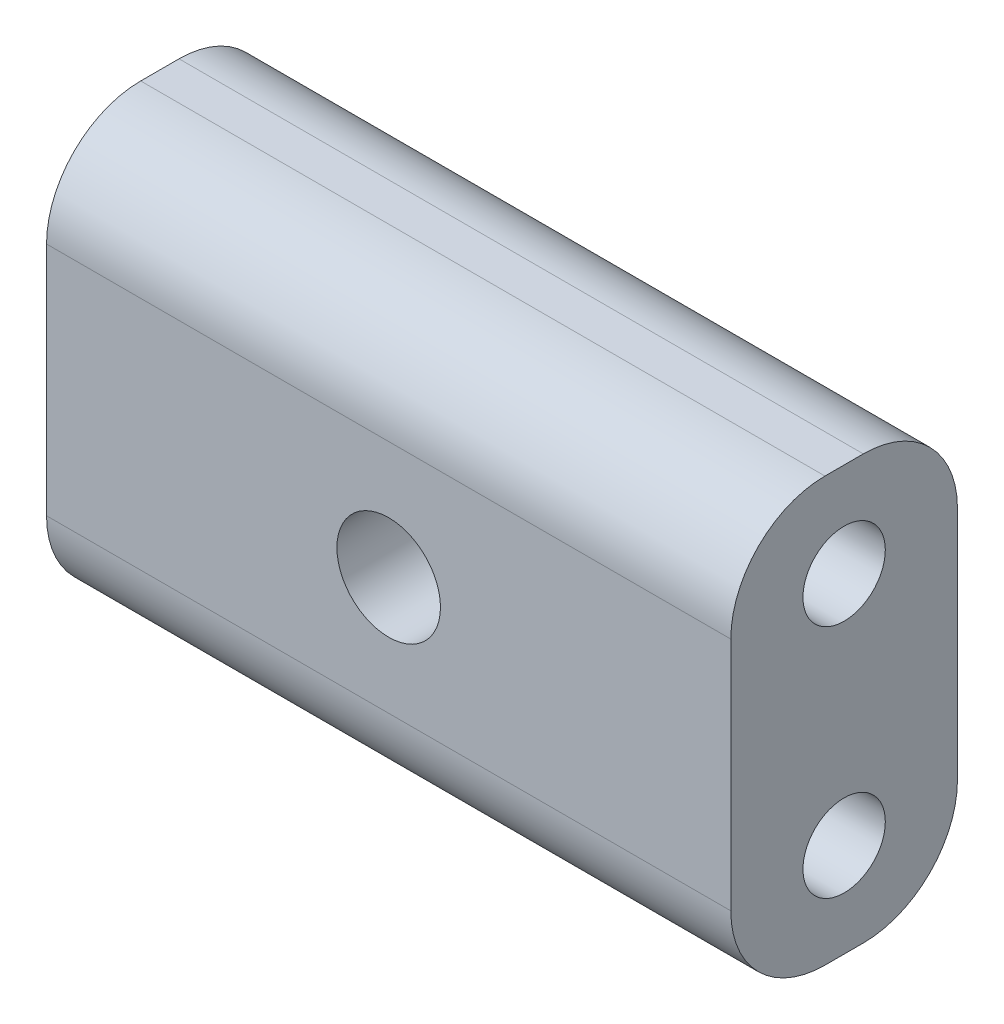
from build123d import *

# Parameters (mm, degrees)
SKETCH1_W         = 29.075
SKETCH1_H         = 18
EXTRUDE_3_8_DEPTH = 9.63
SKETCH2_R         = 1.75
M4_DRILL_DEPTH    = 8
M4_DRILL2_START   = -8
SKETCH3_R         = 1.75
M4_DRILL2_DEPTH   = 8
SKETCH5_R         = 2.2
M5_DRILL_DEPTH    = 9.63
FILLET1_R         = 4


with BuildPart() as part:
    # Sketch1 → 3/8 (new body)
    with BuildSketch(Plane.XY):
        Rectangle(SKETCH1_W, SKETCH1_H)
    extrude(amount=EXTRUDE_3_8_DEPTH)

    # Sketch2 → M4_DRILL (cut)
    with BuildSketch(Plane.ZY.offset(14.5375)):
        with Locations((4.815, 5)):
            Circle(SKETCH2_R)
        with Locations(Location((4.815, -5, 0), (0, 0, 180))):
            Circle(SKETCH2_R)
    extrude(amount=-M4_DRILL_DEPTH, mode=Mode.SUBTRACT)

    # Sketch3 → M4_DRILL2 (cut)
    with BuildSketch(Plane(origin=(14.5375, 0, 0), x_dir=(0, 0, -1), z_dir=(1, 0, 0)).offset(M4_DRILL2_START)):
        with Locations((-4.815, -5)):
            Circle(SKETCH3_R)
        with Locations(Location((-4.815, 5, 0), (0, 0, 180))):
            Circle(SKETCH3_R)
    extrude(amount=M4_DRILL2_DEPTH, mode=Mode.SUBTRACT)

    # Sketch5 → M5_DRILL (cut)
    with BuildSketch(Plane(origin=(0, 0, 0), x_dir=(-1, 0, 0), z_dir=(0, 0, -1))):
        Circle(SKETCH5_R)
    extrude(amount=-M5_DRILL_DEPTH, mode=Mode.SUBTRACT)

    # Fillet1
    fillet1_edges = [part.edges().sort_by_distance(p)[0] for p in [
        (0, -9, 9.63),
        (0, -9, 0),
        (0, 9, 0),
        (0, 9, 9.63),
    ]]
    fillet(fillet1_edges, radius=FILLET1_R)


solid = part.part
